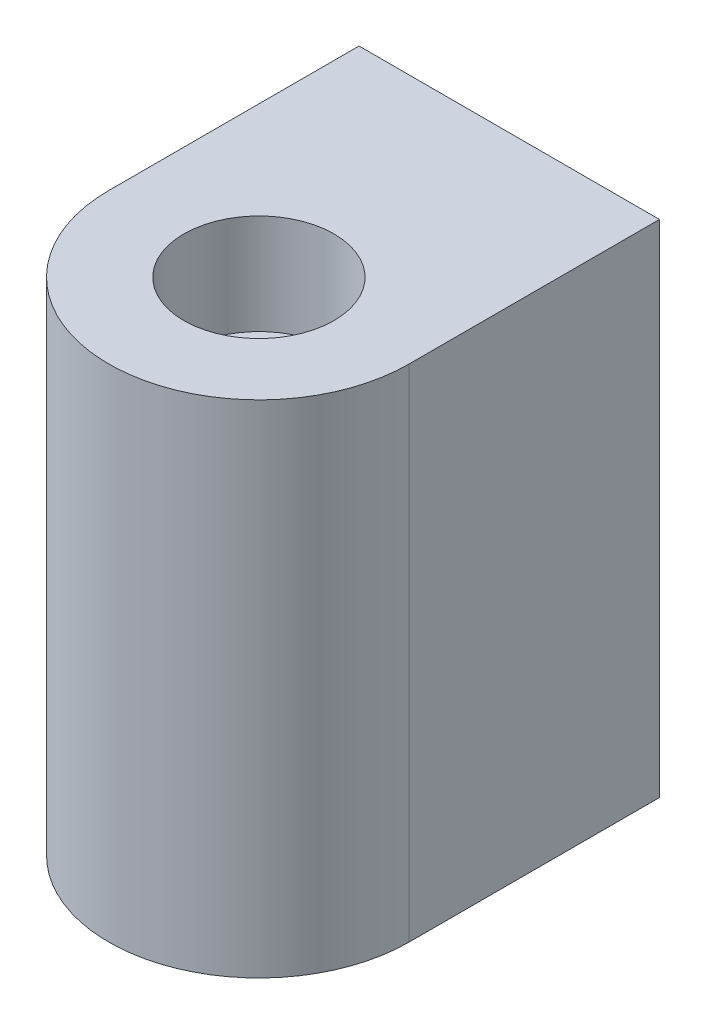
from build123d import *

# Parameters (mm, degrees)
SKETCH1_W           = 6
SKETCH1_H           = 10
BOSS_EXTRUDE1_DEPTH = 8
FILLET2_RADIUS      = 3
FILLET2_LENGTH      = 10
SKETCH2_R           = 1.5
CUT_EXTRUDE1_DEPTH  = 2


with BuildPart() as part:
    # Sketch1 → Boss-Extrude1 (new body)
    with BuildSketch(Plane.XY):
        Rectangle(SKETCH1_W, SKETCH1_H)
    extrude(amount=BOSS_EXTRUDE1_DEPTH)

    # Fillet2: full round fillet: the end face becomes a half cylinder, R = half its width
    fillet2_face = Plane((0, 0, 8), x_dir=(0, -1, 0), z_dir=(0, 0, 1))  # on the end face: x along it, z out of the body
    fillet2_slab = fillet2_face.offset(-FILLET2_RADIUS / 2) * Box(FILLET2_LENGTH, 2 * FILLET2_RADIUS, FILLET2_RADIUS, mode=Mode.PRIVATE)  # the body's end, R deep
    fillet2_round = Plane((0, 0, 5), x_dir=(0, 0, 1), z_dir=(0, -1, 0)) * Cylinder(FILLET2_RADIUS, FILLET2_LENGTH, mode=Mode.PRIVATE)  # its axis R under the face
    add(fillet2_slab - fillet2_round, mode=Mode.SUBTRACT)

    # Sketch2 → Cut-Extrude1 (cut)
    with BuildSketch(Plane(origin=(0, 5, 0), x_dir=(1, 0, 0), z_dir=(0, 1, 0))):
        with Locations(Location((0, -5, 0), (0, 0, 270))):
            Circle(SKETCH2_R)
    extrude(amount=-CUT_EXTRUDE1_DEPTH, mode=Mode.SUBTRACT)


solid = part.part
